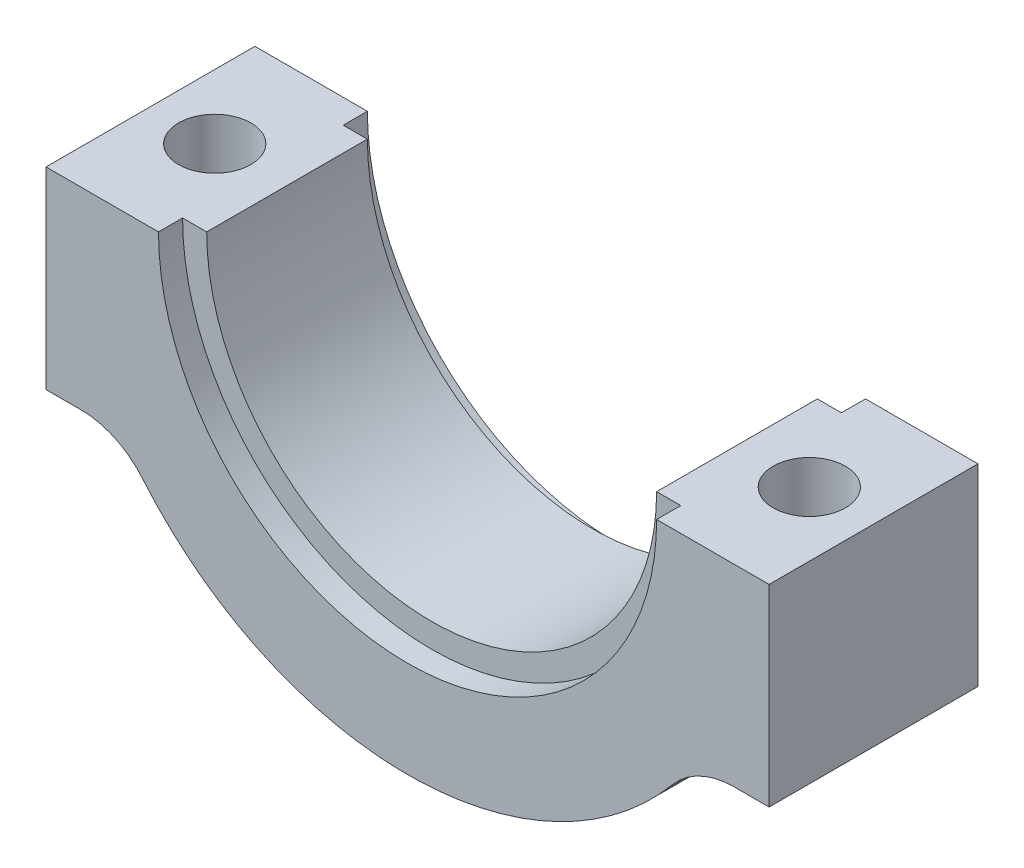
from build123d import *

# Parameters (mm, degrees)
EXTRUDE_1_DEPTH     = 13
EXTRUDE_2_DEPTH     = 10
SKETCH_4_R          = 4.5
CUT_EXTRUDE_1_DEPTH = 19
SKETCH_5_R          = 7
CUT_EXTRUDE_2_DEPTH = 53.630789468


with BuildPart() as part:
    # Эскиз1 → Бобышка-Вытянуть1 (new, symmetric)
    with BuildSketch(Plane.XY):
        with BuildLine():
            ThreePointArc((40.657102701, -24), (36.423365781, -24.940448593), (32.985951248, -27.58490566))
            ThreePointArc((32.985951248, -27.58490566), (0, -43), (-32.985951248, -27.58490566))
            ThreePointArc((-32.985951248, -27.58490566), (-36.423365781, -24.940448593), (-40.657102701, -24))
            Line((-40.657102701, -24), (-45, -24))
            Line((-45, -24), (-45, 0))
            Line((-45, 0), (-31, 0))
            ThreePointArc((-31, 0), (0, -31), (31, 0))
            Line((31, 0), (45, 0))
            Line((45, 0), (45, -24))
            Line((45, -24), (40.657102701, -24))
        make_face()
    extrude(amount=EXTRUDE_1_DEPTH, both=True)

    # Эскиз3 → Бобышка-Вытянуть2 (add, symmetric)
    with BuildSketch(Plane.XY):
        with BuildLine():
            Line((-31, 0), (-28, 0))
            ThreePointArc((-28, 0), (0, -28), (28, 0))
            Line((28, 0), (31, 0))
            ThreePointArc((31, 0), (0, -31), (-31, 0))
        make_face()
    extrude(amount=EXTRUDE_2_DEPTH, both=True)

    # Эскиз4 → Вырез-Вытянуть1 (cut)
    with BuildSketch(Plane(origin=(0, 0, 0), x_dir=(1, 0, 0), z_dir=(0, 1, 0))):
        with Locations(Location((-37, 0, 0), (0, 0, 270))):
            Circle(SKETCH_4_R)
        with Locations(Location((37, 0, 0), (0, 0, 90))):
            Circle(SKETCH_4_R)
    extrude(amount=-CUT_EXTRUDE_1_DEPTH, mode=Mode.SUBTRACT)

    # Эскиз5 → Вырез-Вытянуть2 (cut, through all)
    with BuildSketch(Plane(origin=(0, -19, 0), x_dir=(1, 0, 0), z_dir=(0, 1, 0))):
        with Locations(Location((-37, 0, 0), (0, 0, 270))):
            Circle(SKETCH_5_R)
        with Locations(Location((37, 0, 0), (0, 0, 301.496282556))):
            Circle(SKETCH_5_R)
    extrude(amount=-CUT_EXTRUDE_2_DEPTH, mode=Mode.SUBTRACT)


solid = part.part
